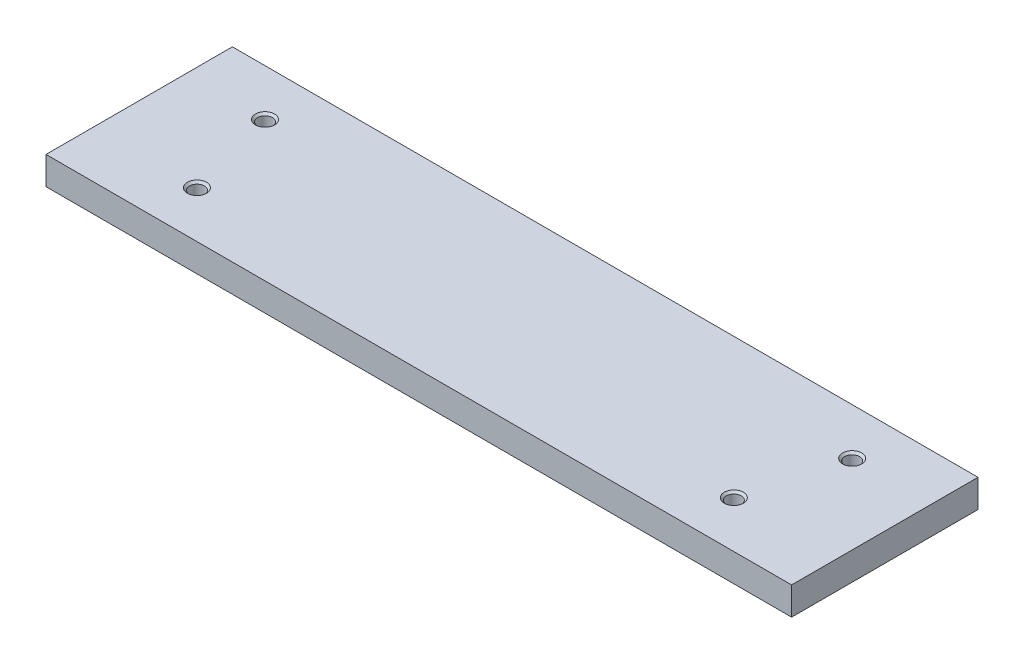
from build123d import *

# Parameters (mm, degrees)
SKETCH_1_W                   = 80
SKETCH_1_H                   = 20
EXTRUDE_1_DEPTH              = 3
HOLE_WIZARD_M2_1_D           = 1.6
HOLE_WIZARD_M2_1_CSINK_D     = 2.05
HOLE_WIZARD_M2_1_CSINK_ANGLE = 90


with BuildPart() as part:
    # 草图1 → 凸台-拉伸1 (new body)
    with BuildSketch(Plane(origin=(0, 0, 0), x_dir=(1, 0, 0), z_dir=(0, 1, 0))):
        with Locations((40, 10)):
            Rectangle(SKETCH_1_W, SKETCH_1_H)
    extrude(amount=EXTRUDE_1_DEPTH)

    # M2 螺纹孔1 (through all)
    with Locations(Plane(origin=(0, 3, 0), x_dir=(1, 0, 0), z_dir=(0, 1, 0))):
        with Locations((8.5, 15), (11.2, 5), (71.5, 15), (68.8, 5)):
            CounterSinkHole(HOLE_WIZARD_M2_1_D / 2, HOLE_WIZARD_M2_1_CSINK_D / 2, counter_sink_angle=HOLE_WIZARD_M2_1_CSINK_ANGLE)


solid = part.part
